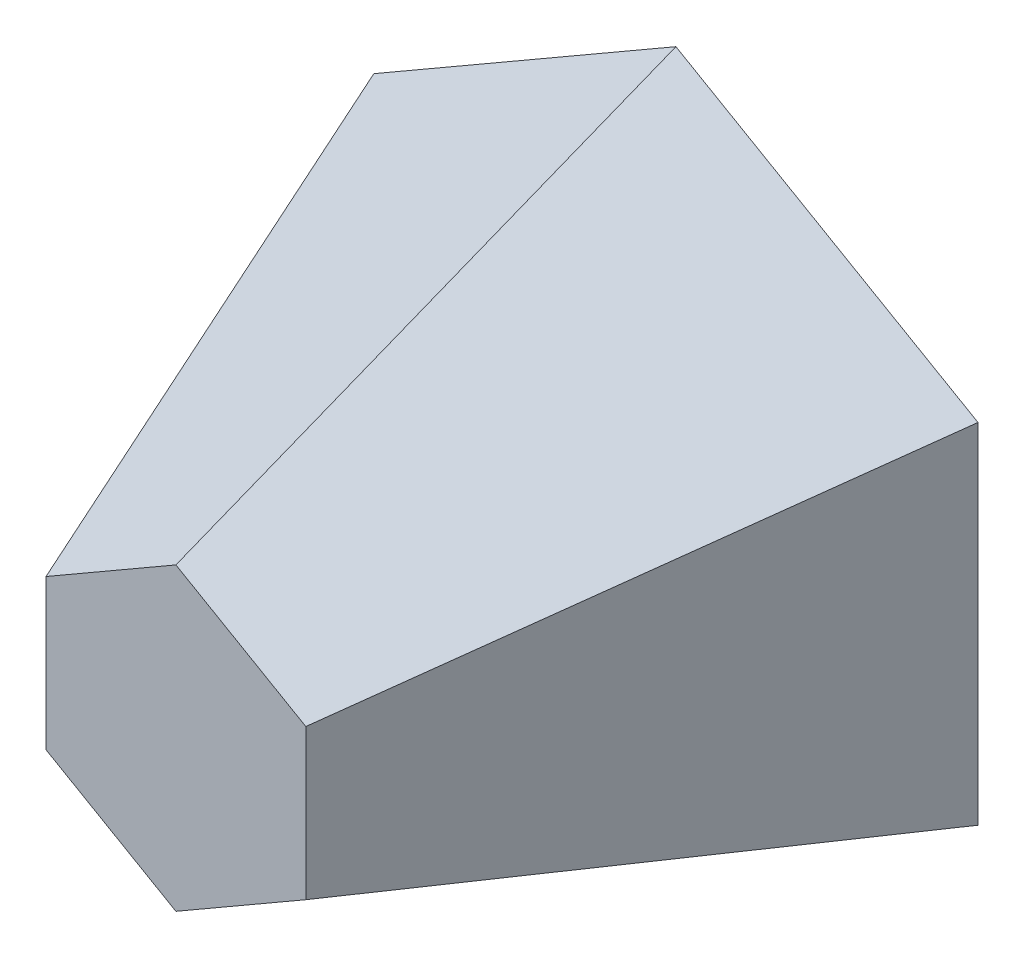
from build123d import *

# Parameters (mm, degrees)
SALIENTE_EXTRUIR1_DEPTH = 125
NGULO_DE_SALIDA1_ANGLE  = 19
VACIADO1_T              = -1.4


with BuildPart() as part:
    # Croquis1 → Saliente-Extruir1 (new, symmetric)
    with BuildSketch(Plane.XY):
        Polygon((0, 75), (-64.951905284, 37.5), (-64.951905284, -37.5), (0, -75), (64.951905284, -37.5), (64.951905284, 37.5), align=None)
    extrude(amount=SALIENTE_EXTRUIR1_DEPTH, both=True)

    # Ángulo de salida1
    ngulo_de_salida1_faces = [part.faces().sort_by_distance(p)[0] for p in [
        (-32.475952642, 56.25, 0),
        (-64.951905284, 0, 0),
        (-32.475952642, -56.25, 0),
        (32.475952642, 56.25, 0),
        (64.951905284, 0, 0),
        (32.475952642, -56.25, 0),
    ]]
    draft(ngulo_de_salida1_faces, Plane.XY.offset(125), NGULO_DE_SALIDA1_ANGLE)

    # Vaciado1
    vaciado1_openings = [part.faces().sort_by_distance(p)[0] for p in [
        (0, 0, -125),
    ]]
    offset(amount=VACIADO1_T, openings=vaciado1_openings, kind=Kind.INTERSECTION)


solid = part.part
